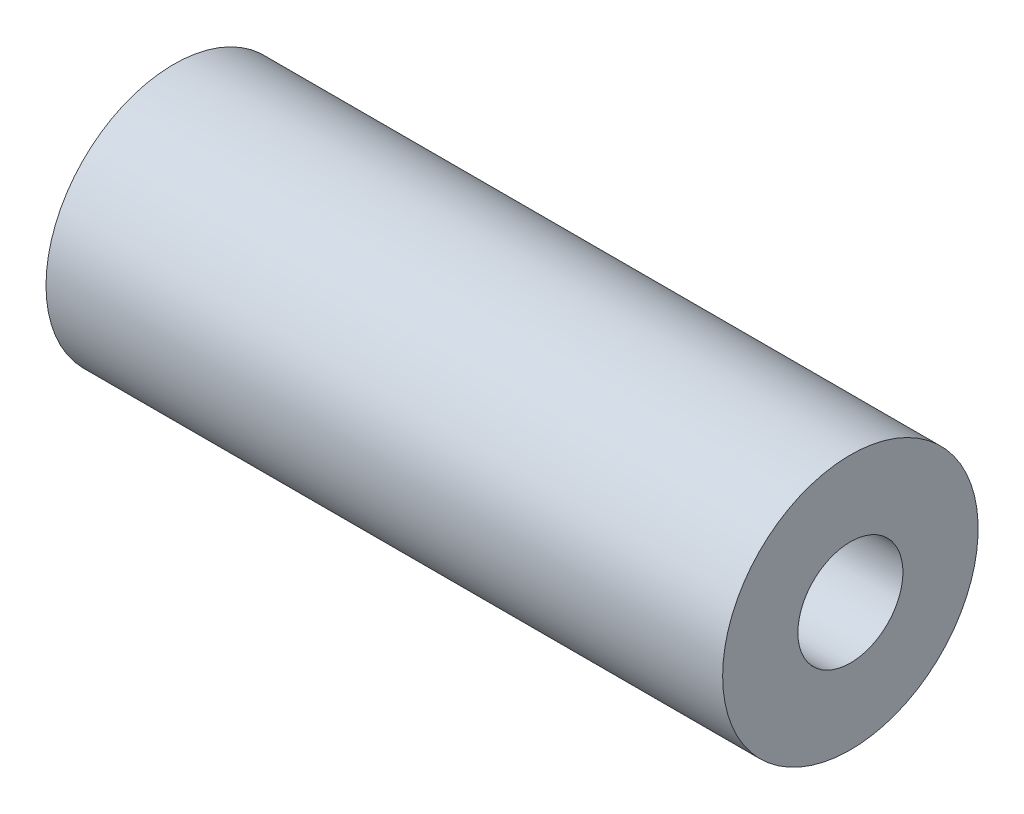
from build123d import *

# Parameters (mm, degrees)
SOCKET_1_SKETCH_W = 16.2
SOCKET_1_SKETCH_H = 3.175
SOCKET_2_SKETCH_W = 16.2
SOCKET_2_SKETCH_H = 3.175


with BuildPart() as part:
    # Union_T4 Sketch → Union_T4 (revolve)
    with BuildSketch(Plane.XY):
        Polygon((-20.45, 0), (-20.45, 7.722), (-3.45, 7.722), (3.45, 7.722), (20.45, 7.722), (20.45, 0), align=None)
    revolve(axis=Axis((-1000, 0, 0), (1, 0, 0)))

    # Socket 1 Sketch → Socket 1 (revolve, cut)
    with BuildSketch(Plane.XY):
        with Locations((-13.35, 1.5875)):
            Rectangle(SOCKET_1_SKETCH_W, SOCKET_1_SKETCH_H)
    revolve(axis=Axis((-1000, 0, 0), (1, 0, 0)), mode=Mode.SUBTRACT)

    # Socket 2 Sketch → Socket 2 (revolve, cut)
    with BuildSketch(Plane.XY):
        with Locations((13.35, 1.5875)):
            Rectangle(SOCKET_2_SKETCH_W, SOCKET_2_SKETCH_H)
    revolve(axis=Axis((-1000, 0, 0), (1, 0, 0)), mode=Mode.SUBTRACT)


solid = part.part
